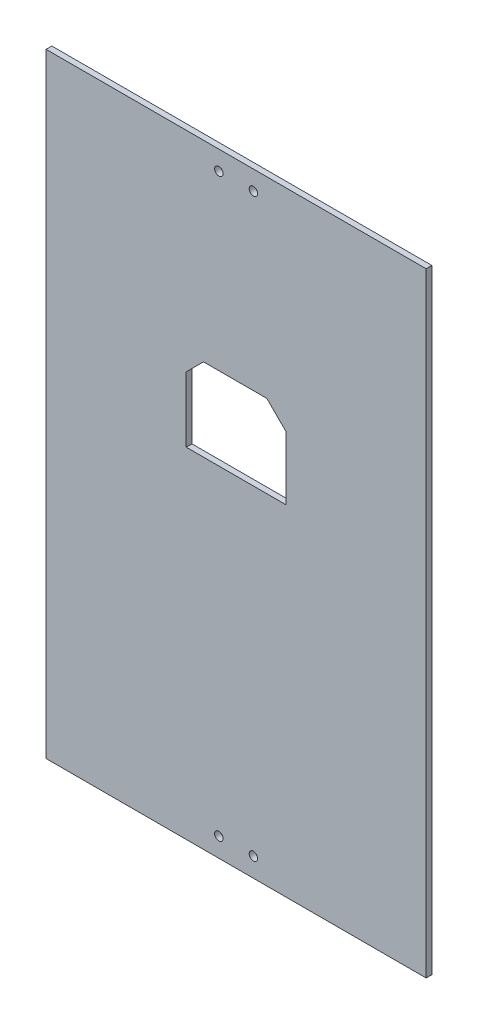
from build123d import *

# Parameters (mm, degrees)
ESQUISSE1_W             = 198
ESQUISSE1_H             = 320
BOSS_EXTRU_1_DEPTH      = 3
ENL_V_MAT_EXTRU_1_REACH = 194.445
ESQUISSE2_R             = 2.2
ENL_V_MAT_EXTRU_3_REACH = 194.445


with BuildPart() as part:
    # Esquisse1 → Boss.-Extru.1 (new body)
    with BuildSketch(Plane.XY):
        with Locations((0, 5)):
            Rectangle(ESQUISSE1_W, ESQUISSE1_H)
    extrude(amount=BOSS_EXTRU_1_DEPTH)

    # Esquisse2 → Enlèv. mat.-Extru.1 (cut, up to next)
    with BuildSketch(Plane.XY.offset(3), mode=Mode.PRIVATE) as enl_v_mat_extru_1_sk1:
        with Locations((9, -145)):
            Circle(ESQUISSE2_R)
    enl_v_mat_extru_1_tool1 = extrude(enl_v_mat_extru_1_sk1.sketch, amount=-ENL_V_MAT_EXTRU_1_REACH, mode=Mode.PRIVATE) & part.part
    # Esquisse2 → Enlèv. mat.-Extru.1 (cut, up to next)
    with BuildSketch(Plane.XY.offset(3), mode=Mode.PRIVATE) as enl_v_mat_extru_1_sk2:
        with Locations((-9, -145)):
            Circle(ESQUISSE2_R)
    enl_v_mat_extru_1_tool2 = extrude(enl_v_mat_extru_1_sk2.sketch, amount=-ENL_V_MAT_EXTRU_1_REACH, mode=Mode.PRIVATE) & part.part
    # Esquisse2 → Enlèv. mat.-Extru.1 (cut, up to next)
    with BuildSketch(Plane.XY.offset(3), mode=Mode.PRIVATE) as enl_v_mat_extru_1_sk3:
        with Locations((-9, 155)):
            Circle(ESQUISSE2_R)
    enl_v_mat_extru_1_tool3 = extrude(enl_v_mat_extru_1_sk3.sketch, amount=-ENL_V_MAT_EXTRU_1_REACH, mode=Mode.PRIVATE) & part.part
    # Esquisse2 → Enlèv. mat.-Extru.1 (cut, up to next)
    with BuildSketch(Plane.XY.offset(3), mode=Mode.PRIVATE) as enl_v_mat_extru_1_sk4:
        with Locations((9, 155)):
            Circle(ESQUISSE2_R)
    enl_v_mat_extru_1_tool4 = extrude(enl_v_mat_extru_1_sk4.sketch, amount=-ENL_V_MAT_EXTRU_1_REACH, mode=Mode.PRIVATE) & part.part
    add(enl_v_mat_extru_1_tool1.solids().sort_by_distance((9, -145, 3))[0], mode=Mode.SUBTRACT)
    add(enl_v_mat_extru_1_tool2.solids().sort_by_distance((-9, -145, 3))[0], mode=Mode.SUBTRACT)
    add(enl_v_mat_extru_1_tool3.solids().sort_by_distance((-9, 155, 3))[0], mode=Mode.SUBTRACT)
    add(enl_v_mat_extru_1_tool4.solids().sort_by_distance((9, 155, 3))[0], mode=Mode.SUBTRACT)

    # Esquisse5 → Enlèv. mat.-Extru.3 (cut, up to next)
    with BuildSketch(Plane.XY.offset(3), mode=Mode.PRIVATE) as enl_v_mat_extru_3_sk1:
        Polygon((0, 22), (26, 22), (26, 55), (16, 65), (-17, 65), (-26, 56), (-26, 22), align=None)
    enl_v_mat_extru_3_tool1 = extrude(enl_v_mat_extru_3_sk1.sketch, amount=-ENL_V_MAT_EXTRU_3_REACH, mode=Mode.PRIVATE) & part.part
    add(enl_v_mat_extru_3_tool1.solids().sort_by_distance((-0.094073, 42.727414, 3))[0], mode=Mode.SUBTRACT)


solid = part.part
